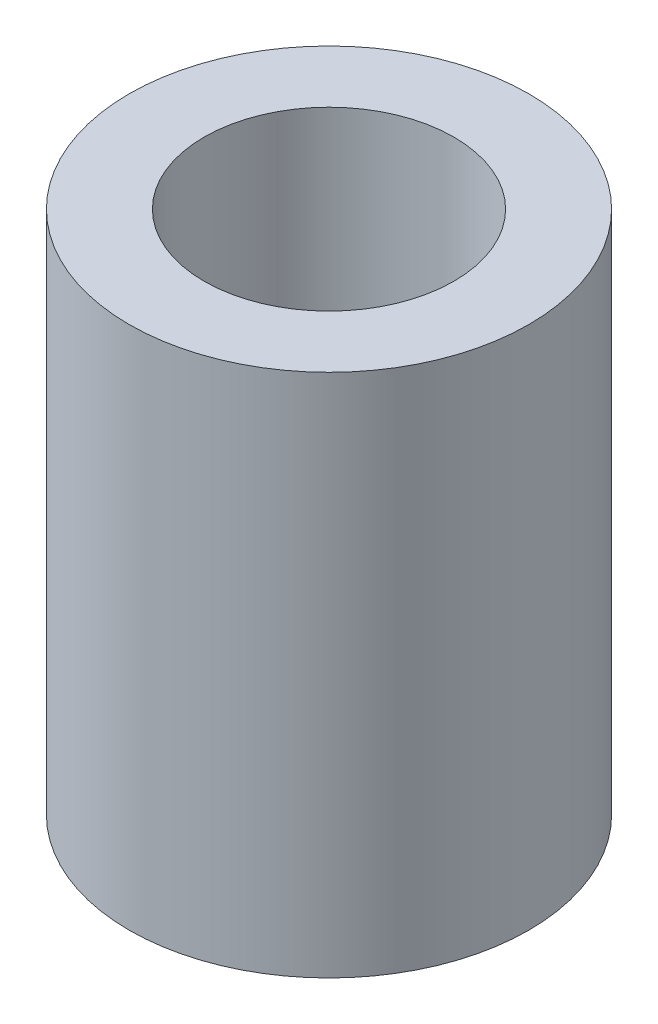
from build123d import *

# Parameters (mm, degrees)
SKETCH_1_R      = 16
SKETCH_1_R_2    = 10
EXTRUDE_1_DEPTH = 42


with BuildPart() as part:
    # 草图1 → 拉伸1 (new body)
    with BuildSketch(Plane(origin=(0, 0, 0), x_dir=(1, 0, 0), z_dir=(0, 1, 0))):
        with Locations(Location((0, 0, 0), (0, 0, 90))):
            Circle(SKETCH_1_R)
        with Locations(Location((0, 0, 0), (0, 0, 90))):
            Circle(SKETCH_1_R_2, mode=Mode.SUBTRACT)
    extrude(amount=EXTRUDE_1_DEPTH)


solid = part.part
